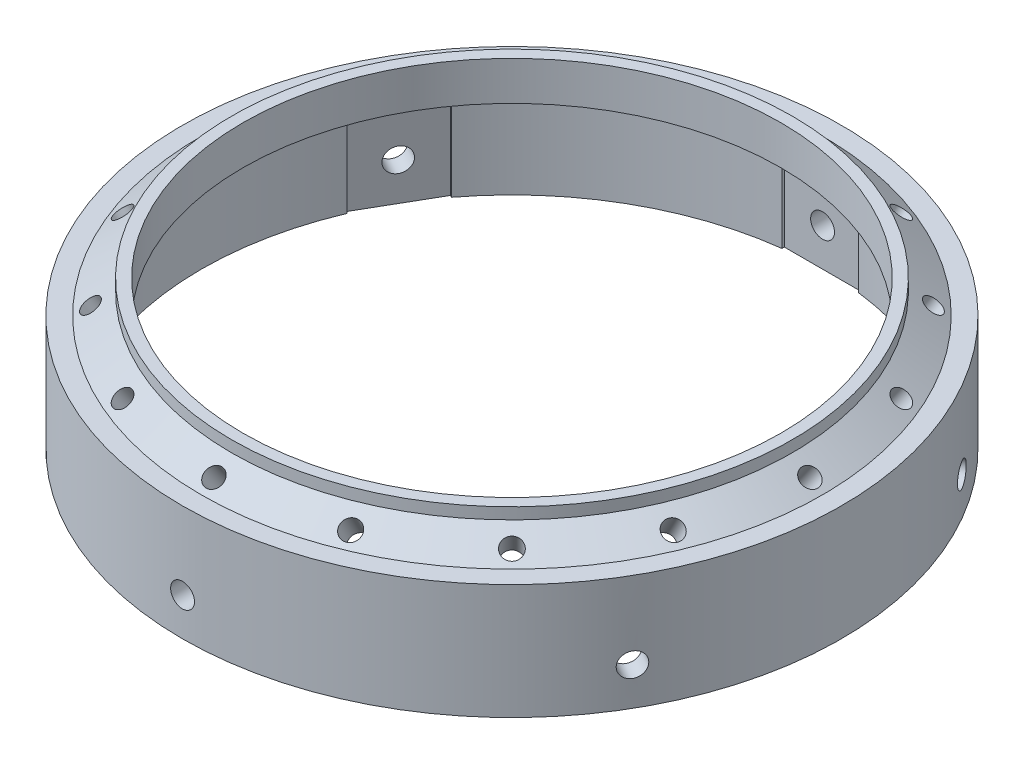
from build123d import *

# Parameters (mm, degrees)
F_4_2MM_DOWEL_HOLE1_D      = 5
CIRPATTERN1_COUNT          = 16
SZKIC2_R                   = 3.15
WYTNIJ_WYCI_GNI_CIE1_DEPTH = 103
SZYK_KO_OWY1_COUNT         = 6
WYTNIJ_WYCI_GNI_CIE2_DEPTH = 21
SZYK_KO_OWY2_COUNT         = 6


with BuildPart() as part:
    # Sketch1 → Revolve1 (revolve)
    with BuildSketch(Plane.XY, mode=Mode.PRIVATE) as revolve1_sk:
        Polygon((-87, 1), (-82, 1), (-74, 6.601660306), (-74, 9.601660306), (-71, 9.601660306), (-71, -0.698132156), (-82, -8.400415076), (-82, -29.400415076), (-87, -29.400415076), align=None)
    revolve(revolve1_sk.sketch.rotate(Axis((0, 0, 0), (0, -1, 0)), 270), axis=Axis((0, 0, 0), (0, -1, 0)))

    # Ø4.2mm Dowel Hole1 (through all)
    with Locations(Plane(origin=(-78.671010072, 3.330983842, 0), x_dir=(0.819152044289, 0.573576436351, 0), z_dir=(-0.573576436351, 0.819152044289, 0))):
        with Locations((1e-09, 0)):
            f_4_2mm_dowel_hole1 = Hole(F_4_2MM_DOWEL_HOLE1_D / 2)

    # CirPattern1: Ø4.2mm Dowel Hole1 ×16 about axis
    cirpattern1_axis = Axis((0, 6.601660306, 0), (0, -1, 0))
    for i in range(1, CIRPATTERN1_COUNT):
        add(f_4_2mm_dowel_hole1.rotate(cirpattern1_axis, i * 360 / CIRPATTERN1_COUNT), mode=Mode.SUBTRACT)

    # Szkic2 → Wytnij-wyciągnięcie1 (cut)
    with BuildSketch(Plane.XY):
        with Locations(Location((0, -19.400415076, 0), (0, 0, 270))):
            Circle(SZKIC2_R)
    wytnij_wyci_gni_cie1 = extrude(amount=WYTNIJ_WYCI_GNI_CIE1_DEPTH, mode=Mode.SUBTRACT)

    # Szyk kołowy1: Wytnij-wyciągnięcie1 ×6 about axis
    szyk_ko_owy1_axis = Axis((0, 0, 0), (0, 1, 0))
    for i in range(1, SZYK_KO_OWY1_COUNT):
        add(wytnij_wyci_gni_cie1.rotate(szyk_ko_owy1_axis, i * 360 / SZYK_KO_OWY1_COUNT), mode=Mode.SUBTRACT)

    # Szkic4 → Wytnij-wyciągnięcie2 (cut)
    with BuildSketch(Plane(origin=(0, -29.400415076, 0), x_dir=(-1, 0, 0), z_dir=(0, -1, 0))):
        Polygon((0, 82), (-10.1, 82), (-10.1, 79.655354279), (10.1, 79.655354279), (10.1, 82), align=None)
    wytnij_wyci_gni_cie2 = extrude(amount=-WYTNIJ_WYCI_GNI_CIE2_DEPTH, mode=Mode.SUBTRACT)

    # Szyk kołowy2: Wytnij-wyciągnięcie2 ×6 about axis
    szyk_ko_owy2_axis = Axis((0, 0, 0), (0, 1, 0))
    for i in range(1, SZYK_KO_OWY2_COUNT):
        add(wytnij_wyci_gni_cie2.rotate(szyk_ko_owy2_axis, i * 360 / SZYK_KO_OWY2_COUNT), mode=Mode.SUBTRACT)


solid = part.part
